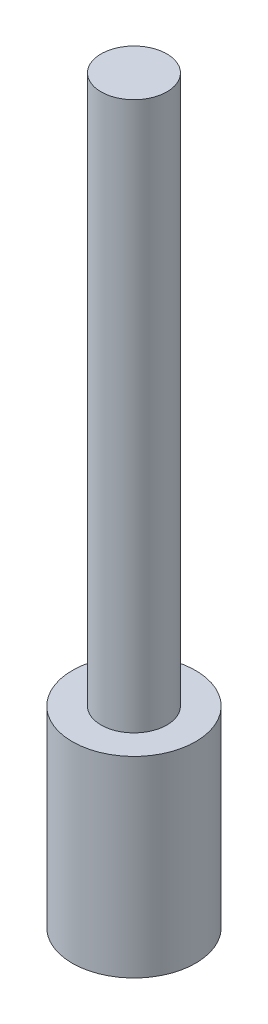
from build123d import *

# Parameters (mm, degrees)
SKETCH2_R           = 4.5
BOSS_EXTRUDE1_DEPTH = 14
CUT_EXTRUDE1_DEPTH  = 9
SKETCH3_R           = 2.4
BOSS_EXTRUDE2_DEPTH = 40


with BuildPart() as part:
    # Sketch2 → Boss-Extrude1 (new body)
    with BuildSketch(Plane(origin=(0, 0, 0), x_dir=(1, 0, 0), z_dir=(0, 1, 0))):
        with Locations(Location((0, 0, 0), (0, 0, 270))):
            Circle(SKETCH2_R)
    extrude(amount=BOSS_EXTRUDE1_DEPTH)

    # Sketch4 → Cut-Extrude1 (cut)
    with BuildSketch(Plane.XZ):
        with BuildLine():
            ThreePointArc((1.5, 0), (0.823094575, 1.253999729), (-0.596687094, 1.376213832))
            Line((-0.596687094, 1.376213832), (-1.301393736, -0.74590505))
            ThreePointArc((-1.301393736, -0.74590505), (0.385946496, -1.449498293), (1.5, 0))
        make_face()
    extrude(amount=-CUT_EXTRUDE1_DEPTH, mode=Mode.SUBTRACT)

    # Sketch3 → Boss-Extrude2 (add)
    with BuildSketch(Plane(origin=(0, 14, 0), x_dir=(1, 0, 0), z_dir=(0, 1, 0))):
        with Locations(Location((0, 0, 0), (0, 0, 270))):
            Circle(SKETCH3_R)
    extrude(amount=BOSS_EXTRUDE2_DEPTH)


solid = part.part
